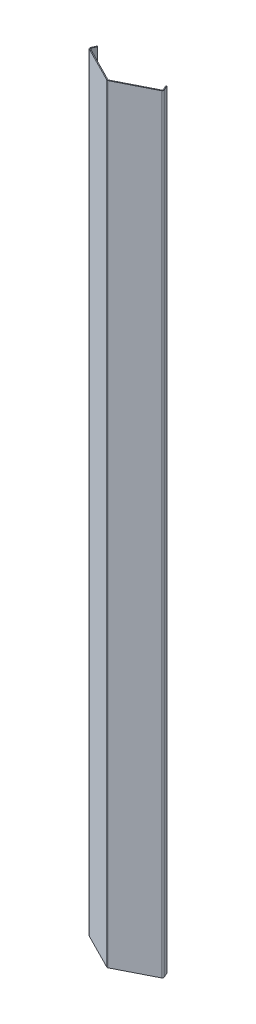
from build123d import *

# Parameters (mm, degrees)
BOSS_EXTRUDE2_DEPTH = 4665


with BuildPart() as part:
    # Sketch1 → Boss-Extrude2 (new body)
    with BuildSketch(Plane(origin=(0, 0, 0), x_dir=(1, 0, 0), z_dir=(0, 1, 0))):
        with BuildLine():
            Line((319.222222222, 134.965277778), (331.494858512, 107.65046142))
            ThreePointArc((331.494858512, 107.65046142), (331.801527991, 100.219250383), (326.892771492, 94.631670113))
            Line((326.892771492, 94.631670113), (112.709917293, -13.883323219))
            ThreePointArc((112.709917293, -13.883323219), (108.190412513, -14.962892929), (103.670907733, -13.883323219))
            Line((103.670907733, -13.883323219), (-110.511946465, 94.631670113))
            ThreePointArc((-110.511946465, 94.631670113), (-115.420702964, 100.219250383), (-115.114033485, 107.65046142))
            Line((-115.114033485, 107.65046142), (-102.841397196, 134.965277778))
            Line((-102.841397196, 134.965277778), (-98.280601295, 132.916097269))
            Line((-98.280601295, 132.916097269), (-110.553237585, 105.601280911))
            ThreePointArc((-110.553237585, 105.601280911), (-110.706572325, 101.885675393), (-108.252194075, 99.091885258))
            Line((-108.252194075, 99.091885258), (105.930660123, -9.423108074))
            ThreePointArc((105.930660123, -9.423108074), (108.190412513, -9.962892929), (110.450164903, -9.423108074))
            Line((110.450164903, -9.423108074), (324.633019102, 99.091885258))
            ThreePointArc((324.633019102, 99.091885258), (327.087397351, 101.885675393), (326.934062612, 105.601280911))
            Line((326.934062612, 105.601280911), (314.661426322, 132.916097269))
            Line((314.661426322, 132.916097269), (319.222222222, 134.965277778))
        make_face()
    extrude(amount=BOSS_EXTRUDE2_DEPTH)


solid = part.part
